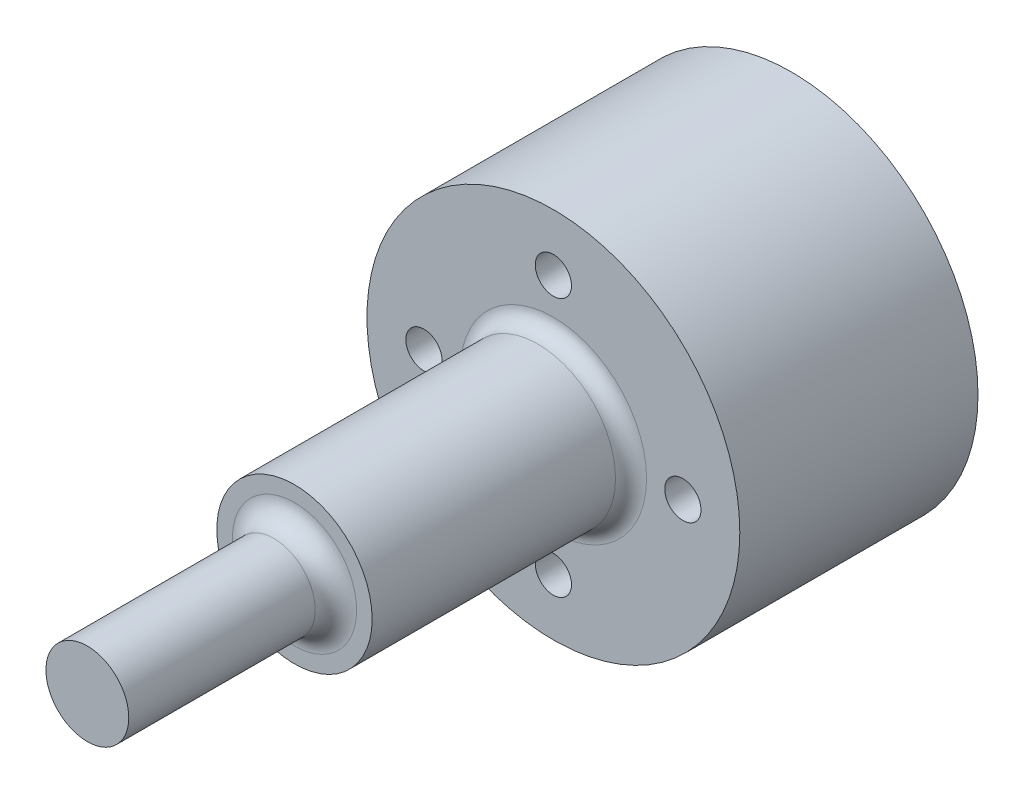
from build123d import *

# Parameters (mm, degrees)
SKETCH_1_R          = 18
SKETCH_1_R_2        = 15
EXTRUDE_1_DEPTH     = 20
SKETCH_2_R          = 18
EXTRUDE_2_DEPTH     = 3
SKETCH_3_R          = 7.5
SKETCH_3_R_2        = 4.5
EXTRUDE_3_DEPTH     = 20
CUT_EXTRUDE_START   = -20
SKETCH_4_R          = 4.5
CUT_EXTRUDE_1_DEPTH = 20
SKETCH_5_R          = 7.5
EXTRUDE_4_DEPTH     = 5
SKETCH_6_R          = 4
EXTRUDE_5_DEPTH     = 20
SKETCH_7_R          = 1.75
CUT_EXTRUDE_2_DEPTH = 15
FILLET_1_R          = 2
FILLET_2_R          = 1.5


with BuildPart() as part:
    # 草图1 → 凸台-拉伸1 (new body)
    with BuildSketch(Plane.XY):
        Circle(SKETCH_1_R)
        Circle(SKETCH_1_R_2, mode=Mode.SUBTRACT)
    extrude(amount=EXTRUDE_1_DEPTH)

    # 草图2 → 凸台-拉伸2 (add)
    with BuildSketch(Plane.XY.offset(20)):
        Circle(SKETCH_2_R)
    extrude(amount=EXTRUDE_2_DEPTH)

    # 草图3 → 凸台-拉伸3 (add)
    with BuildSketch(Plane.XY.offset(23)):
        Circle(SKETCH_3_R)
        Circle(SKETCH_3_R_2, mode=Mode.SUBTRACT)
    extrude(amount=EXTRUDE_3_DEPTH)

    # 草图4 → 切除-拉伸1 (cut)
    with BuildSketch(Plane.XY.offset(23).offset(CUT_EXTRUDE_START)):
        Circle(SKETCH_4_R)
    extrude(amount=CUT_EXTRUDE_1_DEPTH, mode=Mode.SUBTRACT)

    # 草图5 → 凸台-拉伸4 (add)
    with BuildSketch(Plane.XY.offset(43)):
        Circle(SKETCH_5_R)
    extrude(amount=EXTRUDE_4_DEPTH)

    # 草图6 → 凸台-拉伸5 (add)
    with BuildSketch(Plane.XY.offset(48)):
        Circle(SKETCH_6_R)
    extrude(amount=EXTRUDE_5_DEPTH)

    # 草图7 → 切除-拉伸2 (cut)
    with BuildSketch(Plane.XY.offset(23)):
        with Locations((0, 12.5)):
            Circle(SKETCH_7_R)
        with Locations((12.5, 0)):
            Circle(SKETCH_7_R)
        with Locations((0, -12.5)):
            Circle(SKETCH_7_R)
        with Locations((-12.5, 0)):
            Circle(SKETCH_7_R)
    extrude(amount=-CUT_EXTRUDE_2_DEPTH, mode=Mode.SUBTRACT)

    # 圆角1
    fillet_1_edges = [part.edges().sort_by_distance(p)[0] for p in [
        (-4, 0, 48),
    ]]
    fillet(fillet_1_edges, radius=FILLET_1_R)

    # 圆角2
    fillet_2_edges = [part.edges().sort_by_distance(p)[0] for p in [
        (-7.5, 0, 23),
    ]]
    fillet(fillet_2_edges, radius=FILLET_2_R)


solid = part.part
